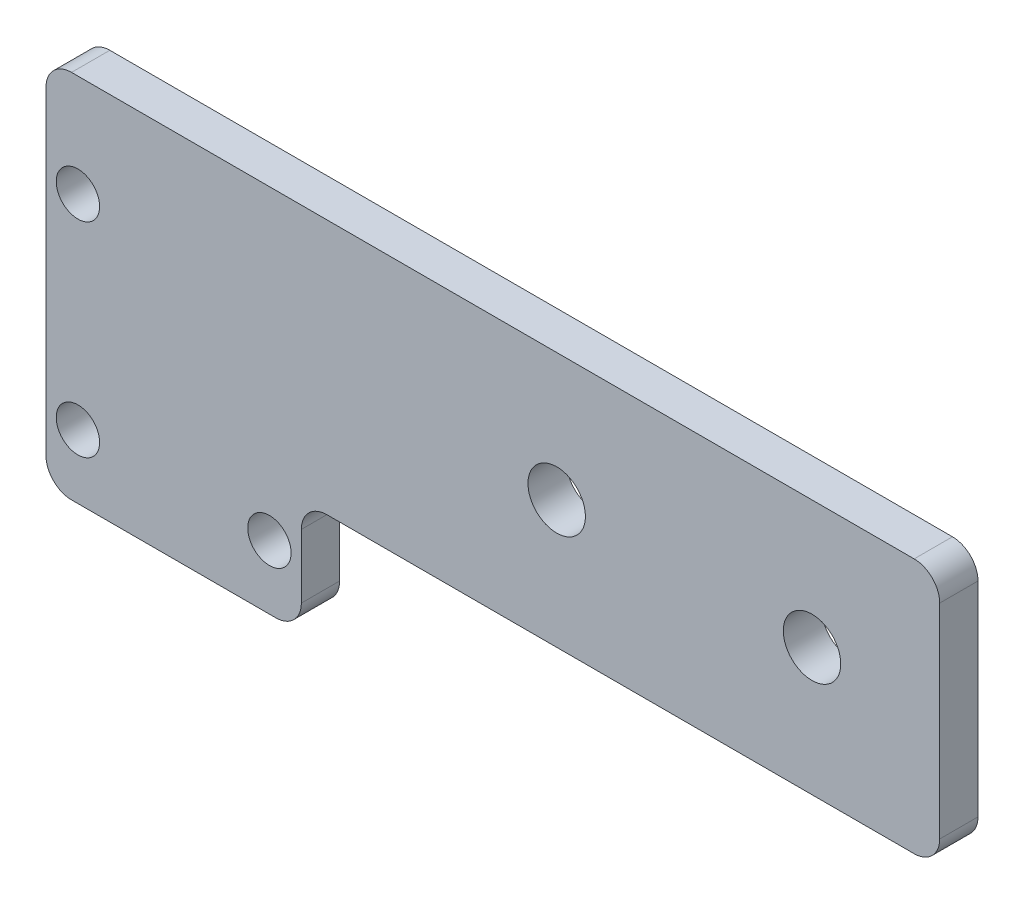
from build123d import *

# Parameters (mm, degrees)
AUFSATZ_LINEAR_AUSTRAGEN1_DEPTH = 3
SKIZZE2_R                       = 1.7
SCHNITT_LINEAR_AUSTRAGEN1_DEPTH = 57.435804238
DURCHGANGSLOCH_F_R_M41_D        = 4.5
DURCHGANGSLOCH_F_R_M31_D        = 3.4
VERRUNDUNG1_R                   = 2
SKIZZE9_W                       = 16
SKIZZE9_H                       = 17
SCHNITT_LINEAR_AUSTRAGEN2_DEPTH = 57.435804238


with BuildPart() as part:
    # Skizze1 → Aufsatz-Linear austragen1 (new body)
    with BuildSketch(Plane.XY):
        with BuildLine():
            Line((0, 0), (0, -9))
            Line((0, -9), (-5, -9))
            Line((-5, -9), (-5, -21))
            ThreePointArc((-5, -21), (-10, -26), (-15, -21))
            Line((-15, -21), (-15, -9))
            Line((-15, -9), (-20, -9))
            Line((-20, -9), (-20, 20))
            Line((-20, 20), (50, 20))
            Line((50, 20), (50, 0))
            Line((50, 0), (0, 0))
        make_face()
    extrude(amount=AUFSATZ_LINEAR_AUSTRAGEN1_DEPTH)

    # Skizze2 → Schnitt-Linear austragen1 (cut, through all)
    with BuildSketch(Plane.XY.offset(3)):
        with Locations((-10, -21)):
            Circle(SKIZZE2_R)
    extrude(amount=-SCHNITT_LINEAR_AUSTRAGEN1_DEPTH, mode=Mode.SUBTRACT)

    # Durchgangsloch für M41 (through all)
    with Locations(Plane.XY.offset(3)):
        with Locations((20, 10), (40, 10)):
            Hole(DURCHGANGSLOCH_F_R_M41_D / 2)

    # Durchgangsloch für M31 (through all)
    with Locations(Plane.XY.offset(3)):
        with Locations((-17.5, 12), (-2.5, -4), (-17.5, -4)):
            Hole(DURCHGANGSLOCH_F_R_M31_D / 2)

    # Verrundung1
    verrundung1_edges = [part.edges().sort_by_distance(p)[0] for p in [
        (0, 0, 1.5),
        (0, -9, 1.5),
        (-5, -9, 1.5),
        (-15, -9, 1.5),
        (-20, -9, 1.5),
        (-20, 20, 1.5),
        (50, 20, 1.5),
        (50, 0, 1.5),
    ]]
    fillet(verrundung1_edges, radius=VERRUNDUNG1_R)

    # Skizze9 → Schnitt-Linear austragen2 (cut, through all)
    with BuildSketch(Plane.XY.offset(3)):
        with Locations((-10, -17.5)):
            Rectangle(SKIZZE9_W, SKIZZE9_H)
    extrude(amount=-SCHNITT_LINEAR_AUSTRAGEN2_DEPTH, mode=Mode.SUBTRACT)


solid = part.part
